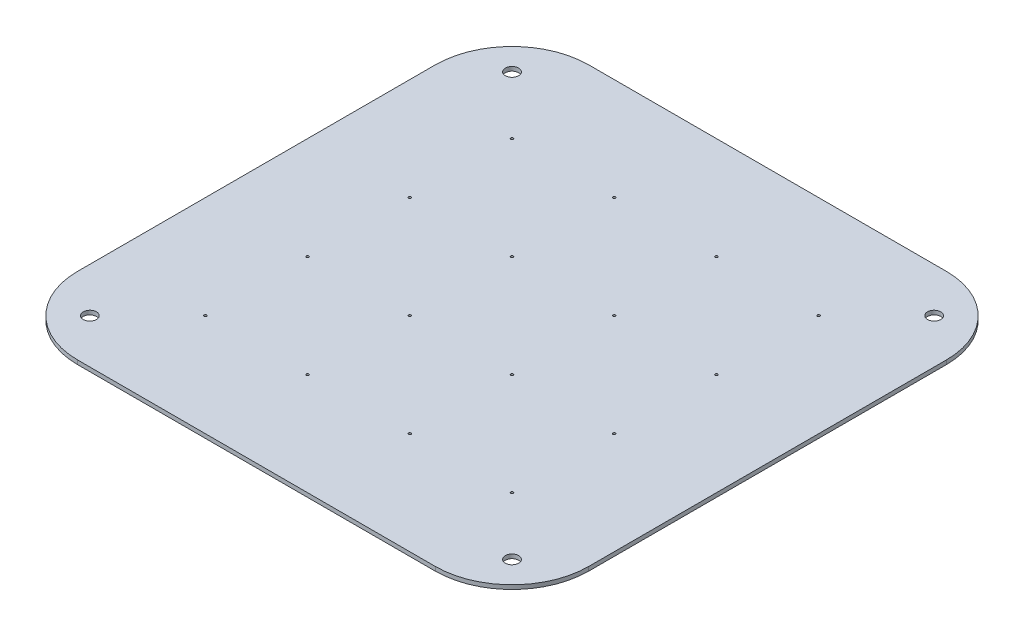
from build123d import *

# Parameters (mm, degrees)
SKETCH1_R           = 2.6
SKETCH1_R_2         = 0.5
BOSS_EXTRUDE1_DEPTH = 1.6


with BuildPart() as part:
    # Sketch1 → Boss-Extrude1 (new body)
    with BuildSketch(Plane(origin=(0, 0, 0), x_dir=(1, 0, 0), z_dir=(0, 1, 0))):
        with BuildLine():
            Line((70, -100), (-70, -100))
            ThreePointArc((-70, -100), (-91.213203436, -91.213203436), (-100, -70))
            Line((-100, -70), (-100, 70))
            ThreePointArc((-100, 70), (-91.213203436, 91.213203436), (-70, 100))
            Line((-70, 100), (70, 100))
            ThreePointArc((70, 100), (91.213203436, 91.213203436), (100, 70))
            Line((100, 70), (100, -70))
            ThreePointArc((100, -70), (91.213203436, -91.213203436), (70, -100))
        make_face()
        with Locations(Location((-82.6, 82.6, 0), (0, 0, 270))):
            Circle(SKETCH1_R, mode=Mode.SUBTRACT)
        with Locations(Location((82.6, 82.6, 0), (0, 0, 270))):
            Circle(SKETCH1_R, mode=Mode.SUBTRACT)
        with Locations(Location((82.6, -82.6, 0), (0, 0, 270))):
            Circle(SKETCH1_R, mode=Mode.SUBTRACT)
        with Locations(Location((-82.6, -82.6, 0), (0, 0, 270))):
            Circle(SKETCH1_R, mode=Mode.SUBTRACT)
        with Locations(Location((-60, 60, 0), (0, 0, 270))):
            Circle(SKETCH1_R_2, mode=Mode.SUBTRACT)
        with Locations(Location((-20, 60, 0), (0, 0, 270))):
            Circle(SKETCH1_R_2, mode=Mode.SUBTRACT)
        with Locations(Location((-20, 20, 0), (0, 0, 270))):
            Circle(SKETCH1_R_2, mode=Mode.SUBTRACT)
        with Locations(Location((-60, 20, 0), (0, 0, 270))):
            Circle(SKETCH1_R_2, mode=Mode.SUBTRACT)
        with Locations(Location((60, 20, 0), (0, 0, 270))):
            Circle(SKETCH1_R_2, mode=Mode.SUBTRACT)
        with Locations(Location((20, 20, 0), (0, 0, 270))):
            Circle(SKETCH1_R_2, mode=Mode.SUBTRACT)
        with Locations(Location((20, 60, 0), (0, 0, 270))):
            Circle(SKETCH1_R_2, mode=Mode.SUBTRACT)
        with Locations(Location((60, 60, 0), (0, 0, 270))):
            Circle(SKETCH1_R_2, mode=Mode.SUBTRACT)
        with Locations(Location((20, -20, 0), (0, 0, 270))):
            Circle(SKETCH1_R_2, mode=Mode.SUBTRACT)
        with Locations(Location((60, -20, 0), (0, 0, 270))):
            Circle(SKETCH1_R_2, mode=Mode.SUBTRACT)
        with Locations(Location((60, -60, 0), (0, 0, 270))):
            Circle(SKETCH1_R_2, mode=Mode.SUBTRACT)
        with Locations(Location((20, -60, 0), (0, 0, 270))):
            Circle(SKETCH1_R_2, mode=Mode.SUBTRACT)
        with Locations(Location((-20, -20, 0), (0, 0, 270))):
            Circle(SKETCH1_R_2, mode=Mode.SUBTRACT)
        with Locations(Location((-60, -20, 0), (0, 0, 270))):
            Circle(SKETCH1_R_2, mode=Mode.SUBTRACT)
        with Locations(Location((-20, -60, 0), (0, 0, 270))):
            Circle(SKETCH1_R_2, mode=Mode.SUBTRACT)
        with Locations(Location((-60, -60, 0), (0, 0, 270))):
            Circle(SKETCH1_R_2, mode=Mode.SUBTRACT)
    extrude(amount=BOSS_EXTRUDE1_DEPTH)


solid = part.part
